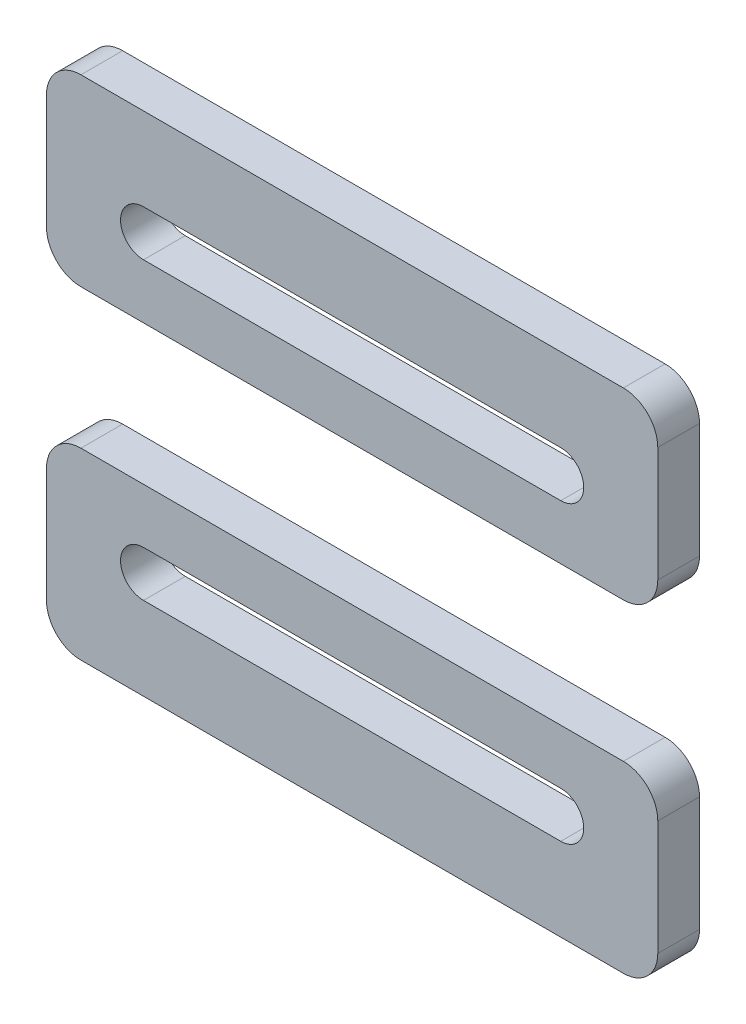
from build123d import *

# Parameters (mm, degrees)
SALIENTE_EXTRUIR1_DEPTH   = 2
SALIENTE_EXTRUIR1_2_DEPTH = 2
CORTAR_EXTRUIR1_START     = -2
CORTAR_EXTRUIR1_DEPTH     = 2


with BuildPart() as part:
    # Croquis1 → Saliente-Extruir1 (new body)
    with BuildSketch(Plane.XY):
        with BuildLine():
            Line((-24.78394795, -5.517569271), (-24.78394795, -11.017569271))
            ThreePointArc((-24.78394795, -11.017569271), (-24.198161512, -12.431782834), (-22.78394795, -13.017569271))
            Line((-22.78394795, -13.017569271), (3.21605205, -13.017569271))
            ThreePointArc((3.21605205, -13.017569271), (4.630265612, -12.431782834), (5.21605205, -11.017569271))
            Line((5.21605205, -11.017569271), (5.21605205, -5.517569271))
            ThreePointArc((5.21605205, -5.517569271), (4.630265612, -4.103355709), (3.21605205, -3.517569271))
            Line((3.21605205, -3.517569271), (-22.78394795, -3.517569271))
            ThreePointArc((-22.78394795, -3.517569271), (-24.198161512, -4.103355709), (-24.78394795, -5.517569271))
        make_face()
        with BuildLine():
            Line((-19.783948841, -10.047569271), (0.216052941, -10.047569271))
            ThreePointArc((0.216052941, -10.047569271), (1.316052941, -8.947569271), (0.216052941, -7.847569271))
            Line((0.216052941, -7.847569271), (-19.783947059, -7.847569271))
            ThreePointArc((-19.783947059, -7.847569271), (-20.883947954, -8.947568381), (-19.783948841, -10.047569271))
        make_face(mode=Mode.SUBTRACT)
    extrude(amount=SALIENTE_EXTRUIR1_DEPTH)


with BuildPart() as body_2:
    # Croquis1 → Saliente-Extruir1 2 (new body)
    with BuildSketch(Plane.XY):
        with BuildLine():
            Line((5.21605205, -26.517569271), (5.21605205, -21.017569271))
            ThreePointArc((5.21605205, -21.017569271), (4.630265612, -19.603355709), (3.21605205, -19.017569271))
            Line((3.21605205, -19.017569271), (-22.78394795, -19.017569271))
            ThreePointArc((-22.78394795, -19.017569271), (-24.198161512, -19.603355709), (-24.78394795, -21.017569271))
            Line((-24.78394795, -21.017569271), (-24.78394795, -26.517569271))
            ThreePointArc((-24.78394795, -26.517569271), (-24.198161512, -27.931782834), (-22.78394795, -28.517569271))
            Line((-22.78394795, -28.517569271), (3.21605205, -28.517569271))
            ThreePointArc((3.21605205, -28.517569271), (4.630265612, -27.931782834), (5.21605205, -26.517569271))
        make_face()
        with BuildLine():
            Line((-19.783947059, -24.187569271), (0.216052941, -24.187569271))
            ThreePointArc((0.216052941, -24.187569271), (1.316052941, -23.087569271), (0.216052941, -21.987569271))
            Line((0.216052941, -21.987569271), (-19.783948841, -21.987569271))
            ThreePointArc((-19.783948841, -21.987569271), (-20.883947954, -23.087570162), (-19.783947059, -24.187569271))
        make_face(mode=Mode.SUBTRACT)
    extrude(amount=SALIENTE_EXTRUIR1_2_DEPTH)


with BuildPart() as cortar_extruir1_tool:
    # Croquis2 → Cortar-Extruir1 (new body)
    # profile 1 of 2: a face of its own
    with BuildSketch(Plane.XY.offset(2).offset(CORTAR_EXTRUIR1_START)):
        with BuildLine():
            Line((5.21605205, -26.517569271), (5.21605205, -21.017569271))
            ThreePointArc((5.21605205, -21.017569271), (4.630265612, -19.603355709), (3.21605205, -19.017569271))
            Line((3.21605205, -19.017569271), (-22.78394795, -19.017569271))
            ThreePointArc((-22.78394795, -19.017569271), (-24.198161512, -19.603355709), (-24.78394795, -21.017569271))
            Line((-24.78394795, -21.017569271), (-24.78394795, -26.517569271))
            ThreePointArc((-24.78394795, -26.517569271), (-24.198161512, -27.931782834), (-22.78394795, -28.517569271))
            Line((-22.78394795, -28.517569271), (3.21605205, -28.517569271))
            ThreePointArc((3.21605205, -28.517569271), (4.630265612, -27.931782834), (5.21605205, -26.517569271))
        make_face()
        with BuildLine():
            Line((4.86605205, -26.517569271), (4.86605205, -21.017569271))
            ThreePointArc((4.86605205, -21.017569271), (4.382778239, -19.850843082), (3.21605205, -19.367569271))
            Line((3.21605205, -19.367569271), (-22.78394795, -19.367569271))
            ThreePointArc((-22.78394795, -19.367569271), (-23.950674139, -19.850843082), (-24.43394795, -21.017569271))
            Line((-24.43394795, -21.017569271), (-24.43394795, -26.517569271))
            ThreePointArc((-24.43394795, -26.517569271), (-23.950674139, -27.68429546), (-22.78394795, -28.167569271))
            Line((-22.78394795, -28.167569271), (3.21605205, -28.167569271))
            ThreePointArc((3.21605205, -28.167569271), (4.382778239, -27.68429546), (4.86605205, -26.517569271))
        make_face(mode=Mode.SUBTRACT)
    # profile 2 of 2: a face of its own
    with BuildSketch(Plane.XY.offset(2).offset(CORTAR_EXTRUIR1_START)):
        with BuildLine():
            Line((-24.78394795, -5.517569271), (-24.78394795, -11.017569271))
            ThreePointArc((-24.78394795, -11.017569271), (-24.198161512, -12.431782834), (-22.78394795, -13.017569271))
            Line((-22.78394795, -13.017569271), (3.21605205, -13.017569271))
            ThreePointArc((3.21605205, -13.017569271), (4.630265612, -12.431782834), (5.21605205, -11.017569271))
            Line((5.21605205, -11.017569271), (5.21605205, -5.517569271))
            ThreePointArc((5.21605205, -5.517569271), (4.630265612, -4.103355709), (3.21605205, -3.517569271))
            Line((3.21605205, -3.517569271), (-22.78394795, -3.517569271))
            ThreePointArc((-22.78394795, -3.517569271), (-24.198161512, -4.103355709), (-24.78394795, -5.517569271))
        make_face()
        with BuildLine():
            Line((-24.43394795, -5.517569271), (-24.43394795, -11.017569271))
            ThreePointArc((-24.43394795, -11.017569271), (-23.950674139, -12.18429546), (-22.78394795, -12.667569271))
            Line((-22.78394795, -12.667569271), (3.21605205, -12.667569271))
            ThreePointArc((3.21605205, -12.667569271), (4.382778239, -12.18429546), (4.86605205, -11.017569271))
            Line((4.86605205, -11.017569271), (4.86605205, -5.517569271))
            ThreePointArc((4.86605205, -5.517569271), (4.382778239, -4.350843082), (3.21605205, -3.867569271))
            Line((3.21605205, -3.867569271), (-22.78394795, -3.867569271))
            ThreePointArc((-22.78394795, -3.867569271), (-23.950674139, -4.350843082), (-24.43394795, -5.517569271))
        make_face(mode=Mode.SUBTRACT)
    extrude(amount=CORTAR_EXTRUIR1_DEPTH)


with BuildPart() as part_1:
    add(part.part)

    # Cortar-Extruir1: cut by cortar_extruir1_tool
    add(cortar_extruir1_tool.part, mode=Mode.SUBTRACT)


with BuildPart() as body_2_1:
    add(body_2.part)

    # Cortar-Extruir1: cut by cortar_extruir1_tool
    add(cortar_extruir1_tool.part, mode=Mode.SUBTRACT)


solid = Compound([part_1.part, body_2_1.part])
